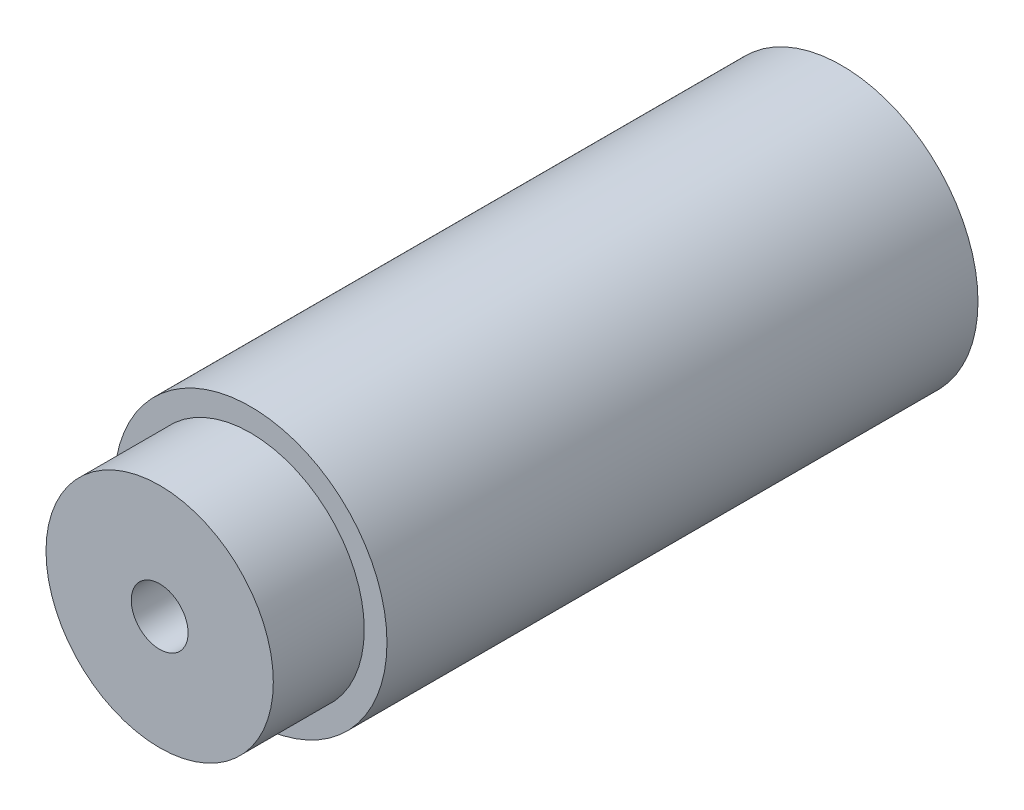
from build123d import *

# Parameters (mm, degrees)
SKETCH_1_R          = 6
EXTRUDE_1_DEPTH     = 30
CUT_EXTRUDE_START   = -4
SKETCH_2_R          = 6
SKETCH_2_R_2        = 5
CUT_EXTRUDE_1_DEPTH = 4
SKETCH_3_R          = 1.25
CUT_EXTRUDE_2_DEPTH = 10


with BuildPart() as part:
    # ｽｹｯﾁ1 → ﾎﾞｽ - 押し出し1 (new body)
    with BuildSketch(Plane.XY):
        Circle(SKETCH_1_R)
    extrude(amount=EXTRUDE_1_DEPTH)

    # ｽｹｯﾁ2 → ｶｯﾄ - 押し出し1 (cut)
    with BuildSketch(Plane.XY.offset(30).offset(CUT_EXTRUDE_START)):
        Circle(SKETCH_2_R)
        Circle(SKETCH_2_R_2, mode=Mode.SUBTRACT)
    extrude(amount=CUT_EXTRUDE_1_DEPTH, mode=Mode.SUBTRACT)

    # ｽｹｯﾁ3 → ｶｯﾄ - 押し出し2 (cut)
    with BuildSketch(Plane.XY.offset(30)):
        Circle(SKETCH_3_R)
    extrude(amount=-CUT_EXTRUDE_2_DEPTH, mode=Mode.SUBTRACT)


solid = part.part
